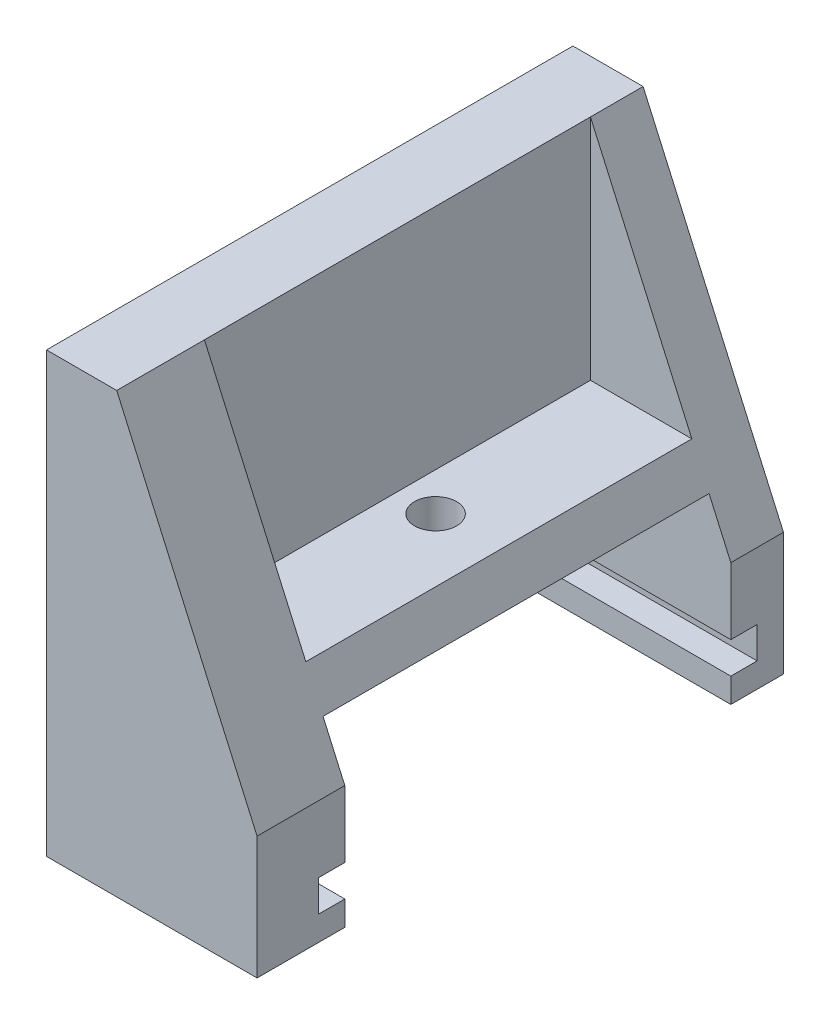
from build123d import *

# Parameters (mm, degrees)
BOSS_EXTRUDE1_DEPTH = 30
SKETCH4_W           = 22
SKETCH4_H           = 10
CUT_EXTRUDE2_DEPTH  = 15
SKETCH5_W           = 1.5
SKETCH5_H           = 1.8
CUT_EXTRUDE3_DEPTH  = 15
CUT_EXTRUDE4_DEPTH  = 11
SKETCH7_R           = 1.2
CUT_EXTRUDE5_DEPTH  = 4


with BuildPart() as part:
    # Sketch1 → Boss-Extrude1 (new body)
    with BuildSketch(Plane.XY):
        Polygon((0, 0), (0, -25), (12, -25), (12, -18), (4, 0), align=None)
    extrude(amount=-BOSS_EXTRUDE1_DEPTH)

    # Sketch4 → Cut-Extrude2 (cut)
    with BuildSketch(Plane.ZY):
        with Locations((-16, -20.207997185)):
            Rectangle(SKETCH4_W, SKETCH4_H)
    extrude(amount=-CUT_EXTRUDE2_DEPTH, mode=Mode.SUBTRACT)

    # Sketch5 → Cut-Extrude3 (cut)
    with BuildSketch(Plane.ZY):
        with Locations((-4.25, -22.7)):
            Rectangle(SKETCH5_W, SKETCH5_H)
    cut_extrude3 = extrude(amount=-CUT_EXTRUDE3_DEPTH, mode=Mode.SUBTRACT)

    # Mirror1: Cut-Extrude3 across plane
    add(cut_extrude3.mirror(Plane.XY.offset(-16)), mode=Mode.SUBTRACT)

    # Sketch6 → Cut-Extrude4 (cut, symmetric)
    with BuildSketch(Plane.XY.offset(-16)):
        Polygon((4, 0), (4, -13), (9.777777778, -13), align=None)
    extrude(amount=CUT_EXTRUDE4_DEPTH, both=True, mode=Mode.SUBTRACT)

    # Sketch7 → Cut-Extrude5 (cut)
    with BuildSketch(Plane(origin=(0, -13, 0), x_dir=(1, 0, 0), z_dir=(0, 1, 0))):
        with Locations(Location((6.172753197, 16, 0), (0, 0, 270))):
            Circle(SKETCH7_R)
    extrude(amount=-CUT_EXTRUDE5_DEPTH, mode=Mode.SUBTRACT)


solid = part.part
